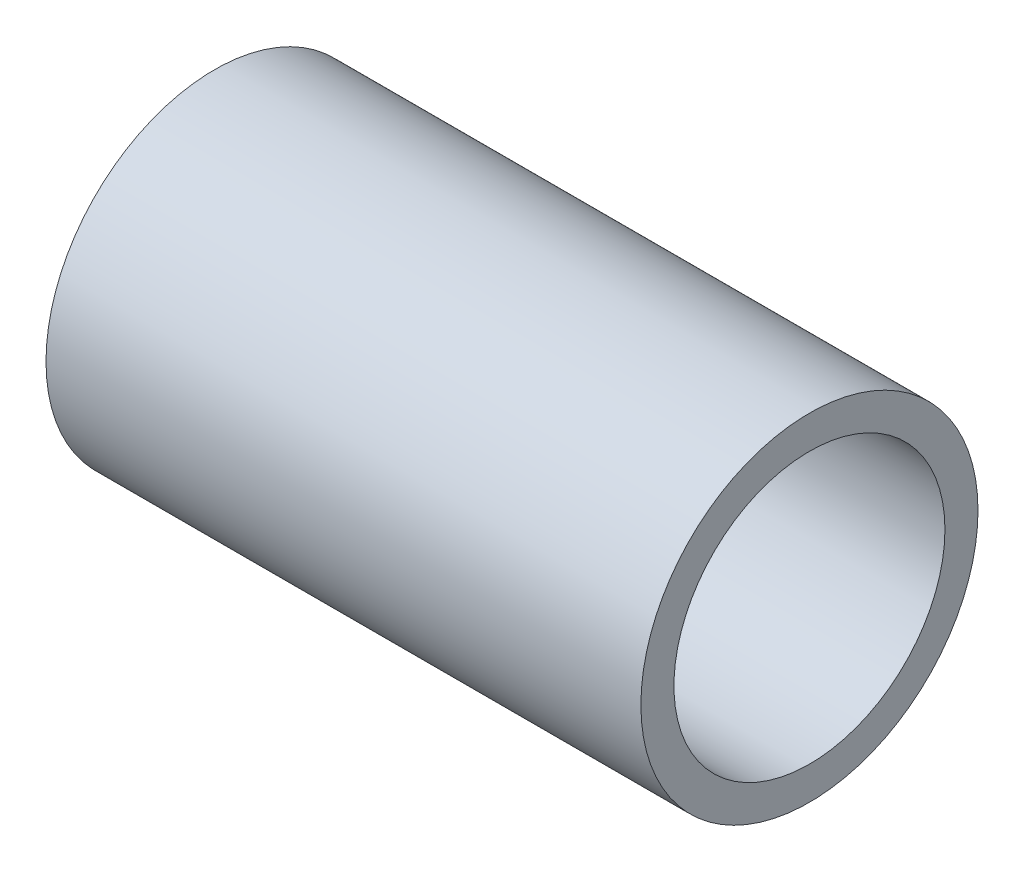
from build123d import *

# Parameters (mm, degrees)
SKIZZE1_R                       = 2.55
SKIZZE1_R_2                     = 2.05
AUFSATZ_LINEAR_AUSTRAGEN1_DEPTH = 9


with BuildPart() as part:
    # Skizze1 → Aufsatz-Linear austragen1 (new body)
    with BuildSketch(Plane(origin=(0, 0, 0), x_dir=(0, 0, -1), z_dir=(1, 0, 0))):
        Circle(SKIZZE1_R)
        Circle(SKIZZE1_R_2, mode=Mode.SUBTRACT)
    extrude(amount=AUFSATZ_LINEAR_AUSTRAGEN1_DEPTH)


solid = part.part
